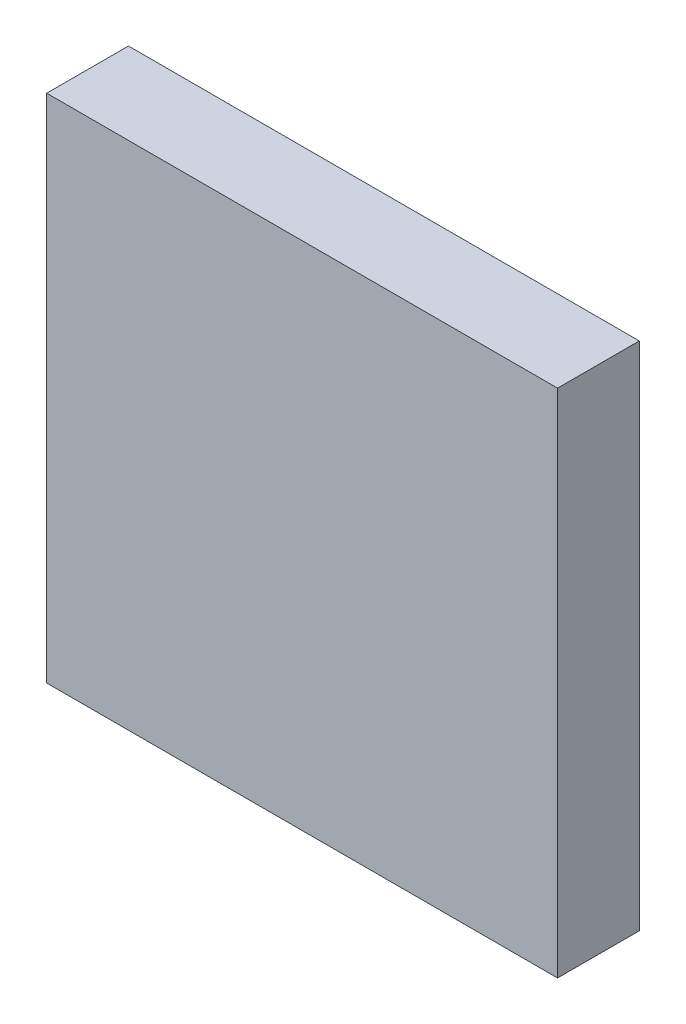
from build123d import *

# Parameters (mm, degrees)
SKETCH1_W           = 25
SKETCH1_H           = 25
BOSS_EXTRUDE1_DEPTH = 4


with BuildPart() as part:
    # Sketch1 → Boss-Extrude1 (new body)
    with BuildSketch(Plane.XY):
        with Locations((12.5, 12.5)):
            Rectangle(SKETCH1_W, SKETCH1_H)
    extrude(amount=BOSS_EXTRUDE1_DEPTH)


solid = part.part
